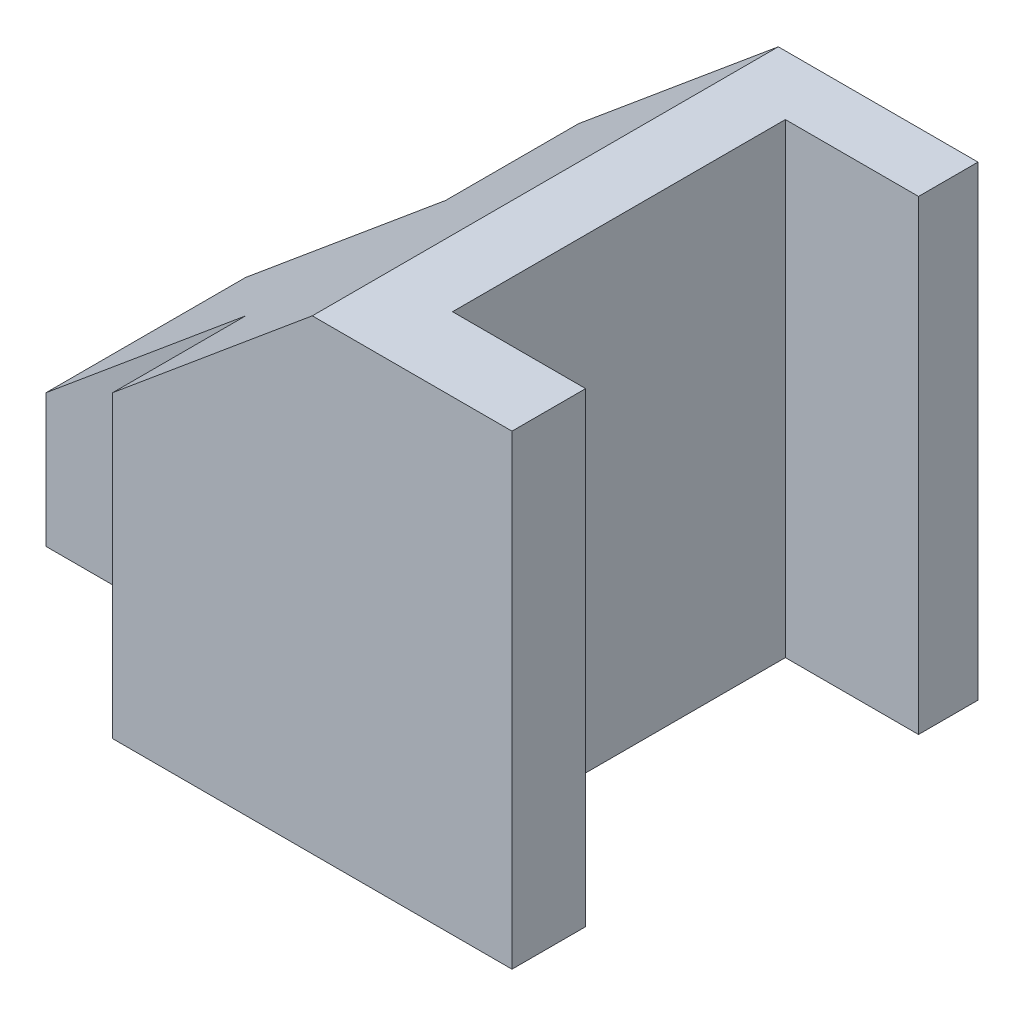
from build123d import *

# Parameters (mm, degrees)
BOSS_EXTRUDE1_DEPTH = 35000
SKETCH3_W           = 10000
SKETCH3_H           = 25000
CUT_EXTRUDE4_DEPTH  = 66896.440801298
CUT_EXTRUDE5_DEPTH  = 10000
CUT_EXTRUDE6_DEPTH  = 10000


with BuildPart() as part:
    # Sketch1 → Boss-Extrude1 (new body)
    with BuildSketch(Plane.XY):
        Polygon((0, 0), (45000, 0), (45000, 35000), (30000, 35000), (0, 10000), align=None)
    extrude(amount=BOSS_EXTRUDE1_DEPTH)

    # Sketch3 → Cut-Extrude4 (cut, through all)
    with BuildSketch(Plane(origin=(0, 35000, 0), x_dir=(1, 0, 0), z_dir=(0, 1, 0))):
        with Locations((40000, -16967.015285599)):
            Rectangle(SKETCH3_W, SKETCH3_H)
    extrude(amount=-CUT_EXTRUDE4_DEPTH, mode=Mode.SUBTRACT)

    # Sketch4 → Cut-Extrude5 (cut)
    with BuildSketch(Plane.XY.offset(35000)):
        Polygon((0, 0), (15000, 0), (15000, 22500), (0, 10000), align=None)
    extrude(amount=-CUT_EXTRUDE5_DEPTH, mode=Mode.SUBTRACT)

    # Sketch5 → Cut-Extrude6 (cut)
    with BuildSketch(Plane(origin=(0, 0, 0), x_dir=(-1, 0, 0), z_dir=(0, 0, -1))):
        Polygon((0, 0), (0, 10000), (-15000, 22500), (-15000, 0), align=None)
    extrude(amount=-CUT_EXTRUDE6_DEPTH, mode=Mode.SUBTRACT)


solid = part.part
